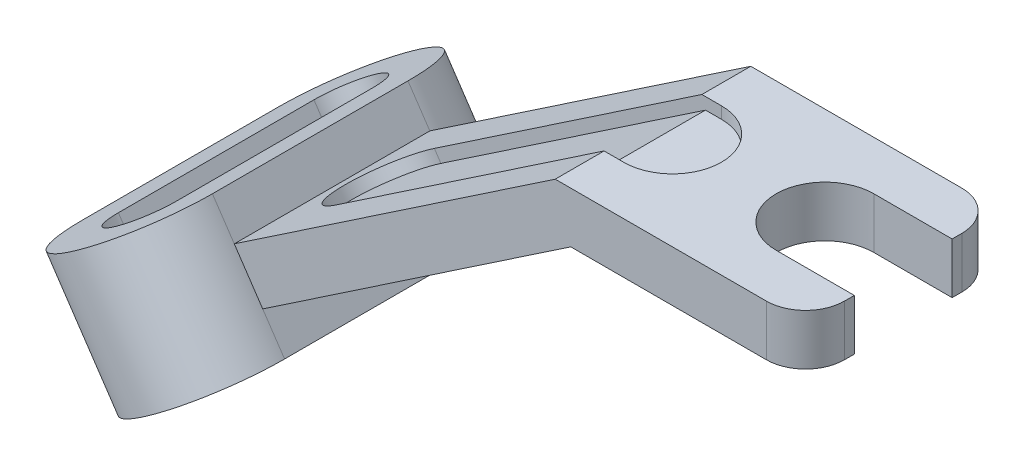
from build123d import *

# Parameters (mm, degrees)
BOSS_EXTRUDE1_DEPTH = 50
BOSS_EXTRUDE2_DEPTH = 16.5
CUT_EXTRUDE1_DEPTH  = 16.5
CUT_EXTRUDE3_DEPTH  = 173.734095702
CUT_EXTRUDE4_DEPTH  = 3
CUT_EXTRUDE5_DEPTH  = 3
FILLET1_R           = 10


with BuildPart() as part:
    # Sketch1 → Boss-Extrude1 (new body)
    with BuildSketch(Plane.XY):
        Polygon((60, 0), (0, 0), (-95.339320844, -64.307183899), (-102.608828589, -53.529695456), (-3.974498859, 13), (60, 13), align=None)
    extrude(amount=BOSS_EXTRUDE1_DEPTH)

    # Sketch3 → Boss-Extrude2 (add, symmetric)
    with BuildSketch(Plane(origin=(-3.634753873, 5.388744222, 0), x_dir=(-0.8290375725550407, -0.5591929034707483, 0), z_dir=(0.5591929034707483, -0.8290375725550407, 0))):
        with BuildLine():
            Line((135, 0), (135, -50))
            ThreePointArc((135, -50), (115, -70), (95, -50))
            Line((95, -50), (95, 0))
            ThreePointArc((95, 0), (115, 20), (135, 0))
        make_face()
        with BuildLine():
            Line((106, -50), (106, 0))
            ThreePointArc((106, 0), (115, 9), (124, 0))
            Line((124, 0), (124, -50))
            ThreePointArc((124, -50), (115, -59), (106, -50))
        make_face(mode=Mode.SUBTRACT)
    extrude(amount=BOSS_EXTRUDE2_DEPTH, both=True)

    # Sketch3<2> → Cut-Extrude1 (cut, symmetric)
    with BuildSketch(Plane(origin=(-3.634753873, 5.388744222, 0), x_dir=(-0.8290375725550407, -0.5591929034707483, 0), z_dir=(0.5591929034707483, -0.8290375725550407, 0))):
        with BuildLine():
            Line((106, -50), (106, 0))
            ThreePointArc((106, 0), (115, 9), (124, 0))
            Line((124, 0), (124, -50))
            ThreePointArc((124, -50), (115, -59), (106, -50))
        make_face()
    extrude(amount=CUT_EXTRUDE1_DEPTH, both=True, mode=Mode.SUBTRACT)

    # Sketch5 → Cut-Extrude3 (cut, through all)
    with BuildSketch(Plane(origin=(0, 13, 0), x_dir=(1, 0, 0), z_dir=(0, 1, 0))):
        with BuildLine():
            Line((40, -37.5), (60, -37.5))
            Line((60, -37.5), (60, -12.5))
            Line((60, -12.5), (40, -12.5))
            ThreePointArc((40, -12.5), (27.5, -25), (40, -37.5))
        make_face()
    extrude(amount=-CUT_EXTRUDE3_DEPTH, mode=Mode.SUBTRACT)

    # Sketch5<3> → Cut-Extrude4 (cut)
    with BuildSketch(Plane(origin=(0, 13, 0), x_dir=(1, 0, 0), z_dir=(0, 1, 0))):
        with BuildLine():
            Line((60, -37.5), (40, -37.5))
            ThreePointArc((40, -37.5), (27.5, -25), (40, -12.5))
            Line((40, -12.5), (60, -12.5))
            ThreePointArc((60, -12.5), (72.5, -25), (60, -37.5))
        make_face()
        with BuildLine():
            Line((-3.974498859, -12.5), (1.025501141, -12.5))
            ThreePointArc((1.025501141, -12.5), (13.525501141, -25), (1.025501141, -37.5))
            Line((1.025501141, -37.5), (-3.974498859, -37.5))
            ThreePointArc((-3.974498859, -37.5), (-16.474498859, -25), (-3.974498859, -12.5))
        make_face()
    extrude(amount=-CUT_EXTRUDE4_DEPTH, mode=Mode.SUBTRACT)

    # Sketch6 → Cut-Extrude5 (cut)
    with BuildSketch(Plane(origin=(-7.269507745, 10.777488443, 0), x_dir=(0.8290375725550407, 0.5591929034707483, 0), z_dir=(-0.5591929034707483, 0.8290375725550407, 0))):
        with BuildLine():
            Line((-78.525501141, -12.5), (3.974498859, -12.5))
            ThreePointArc((3.974498859, -12.5), (16.474498859, -25), (3.974498859, -37.5))
            Line((3.974498859, -37.5), (-78.525501141, -37.5))
            ThreePointArc((-78.525501141, -37.5), (-91.025501141, -25), (-78.525501141, -12.5))
        make_face()
    extrude(amount=-CUT_EXTRUDE5_DEPTH, mode=Mode.SUBTRACT)

    # Fillet1
    fillet1_edges = [part.edges().sort_by_distance(p)[0] for p in [
        (60, 6.5, 0),
        (60, 6.5, 50),
    ]]
    fillet(fillet1_edges, radius=FILLET1_R)


solid = part.part
